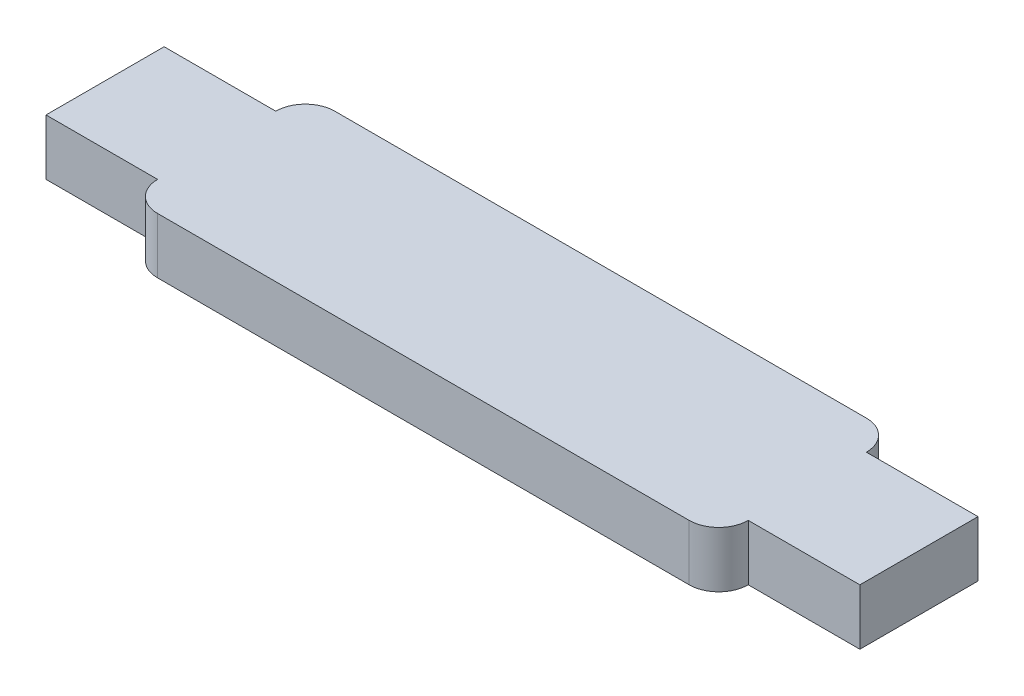
from build123d import *

# Parameters (mm, degrees)
BOSS_EXTRUDE1_DEPTH = 1.5
SKETCH2_W           = 6
SKETCH2_H           = 6.35
BOSS_EXTRUDE2_DEPTH = 3


with BuildPart() as part:
    # Sketch1 → Boss-Extrude1 (new, symmetric)
    with BuildSketch(Plane(origin=(0, 0, 0), x_dir=(1, 0, 0), z_dir=(0, 1, 0))):
        with BuildLine():
            Line((14.2875, -4.7625), (-14.2875, -4.7625))
            ThreePointArc((-14.2875, -4.7625), (-15.410032015, -4.297532015), (-15.875, -3.175))
            Line((-15.875, -3.175), (-15.875, 3.175))
            ThreePointArc((-15.875, 3.175), (-15.410032015, 4.297532015), (-14.2875, 4.7625))
            Line((-14.2875, 4.7625), (14.2875, 4.7625))
            ThreePointArc((14.2875, 4.7625), (15.410032015, 4.297532015), (15.875, 3.175))
            Line((15.875, 3.175), (15.875, -3.175))
            ThreePointArc((15.875, -3.175), (15.410032015, -4.297532015), (14.2875, -4.7625))
        make_face()
    extrude(amount=BOSS_EXTRUDE1_DEPTH, both=True)

    # Sketch2 → Boss-Extrude2 (add)
    with BuildSketch(Plane(origin=(0, 1.5, 0), x_dir=(1, 0, 0), z_dir=(0, 1, 0))):
        with Locations((-18.875, 0)):
            Rectangle(SKETCH2_W, SKETCH2_H)
    boss_extrude2 = extrude(amount=-BOSS_EXTRUDE2_DEPTH)

    # Mirror1: Boss-Extrude2 across plane
    add(boss_extrude2.mirror(Plane(origin=(0, 0, 0), x_dir=(0, 0, 1), z_dir=(1, 0, 0))))


solid = part.part
